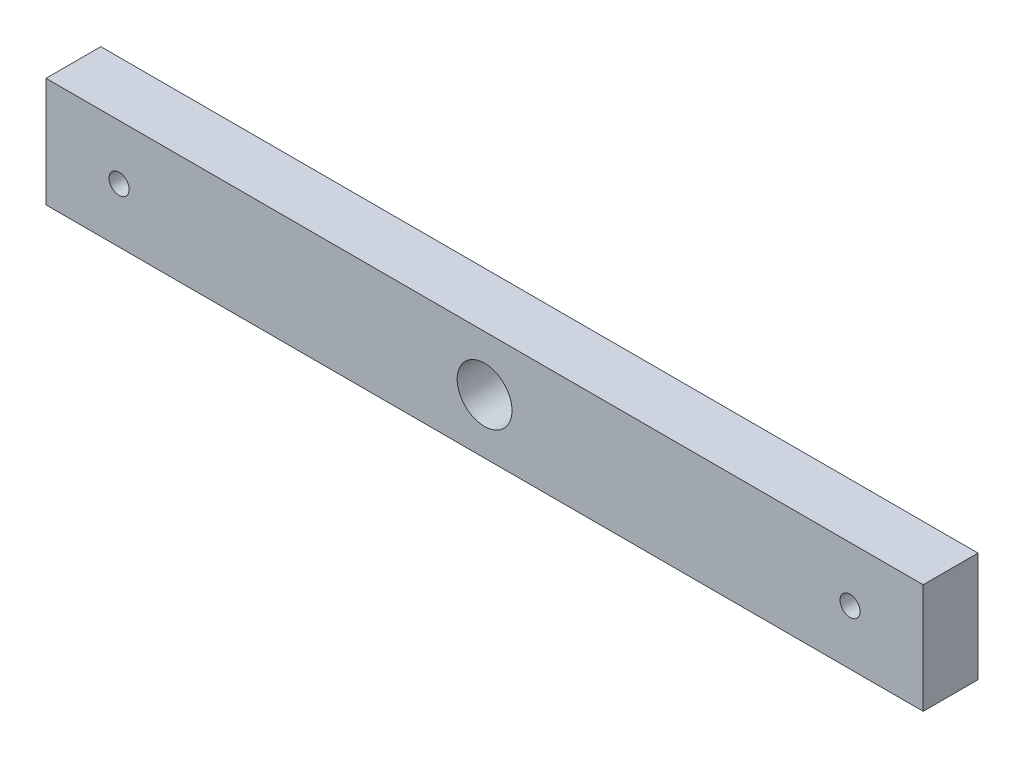
from build123d import *

# Parameters (mm, degrees)
RESSALTO_EXTRUS_O1_DEPTH = 15
CORTE_EXTRUS_O1_DEPTH    = 15
ESBO_O3_R                = 2.75
CORTE_EXTRUS_O2_DEPTH    = 50


with BuildPart() as part:
    # Esboço1 → Ressalto-extrusão1 (new body)
    with BuildSketch(Plane.XY):
        Polygon((100, 0), (-100, 0), (-120, 0), (-120, 30), (-100, 30), (100, 30), (120, 30), (120, 0), align=None)
    extrude(amount=RESSALTO_EXTRUS_O1_DEPTH)

    # Esboço2 → Corte-extrusão1 (cut)
    with BuildSketch(Plane.XY.offset(15)):
        with BuildLine():
            ThreePointArc((7.5, 15), (5.303300859, 20.303300859), (0, 22.5))
            Line((0, 22.5), (0, 7.5))
            ThreePointArc((0, 7.5), (5.303300859, 9.696699141), (7.5, 15))
        make_face()
        with BuildLine():
            Line((0, 7.5), (0, 22.5))
            ThreePointArc((0, 22.5), (-7.5, 15), (0, 7.5))
        make_face()
    extrude(amount=-CORTE_EXTRUS_O1_DEPTH, mode=Mode.SUBTRACT)

    # Esboço3 → Corte-extrusão2 (cut)
    with BuildSketch(Plane.XY.offset(15)):
        with Locations((-100, 15)):
            Circle(ESBO_O3_R)
        with Locations((100, 15)):
            Circle(ESBO_O3_R)
    extrude(amount=-CORTE_EXTRUS_O2_DEPTH, mode=Mode.SUBTRACT)


solid = part.part
